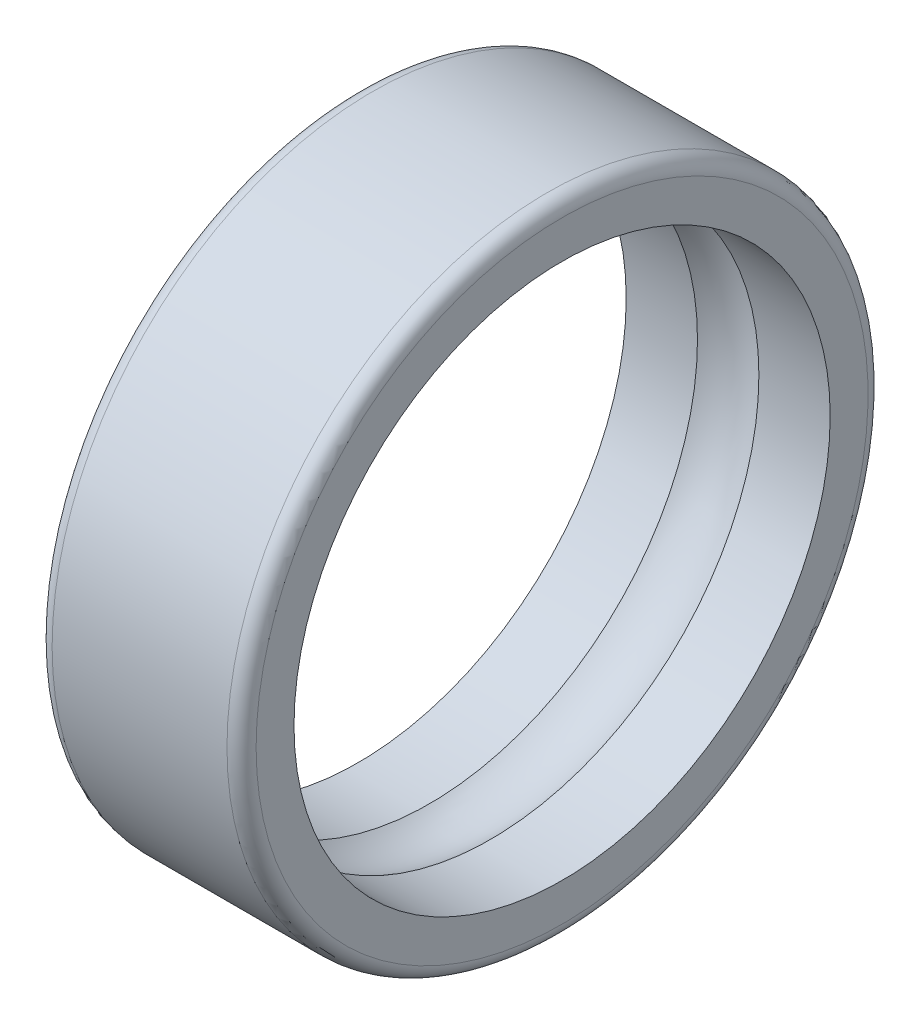
from build123d import *


with BuildPart() as part:
    # Esquisse1 → Base-Révolution (revolve)
    with BuildSketch(Plane.XY, mode=Mode.PRIVATE) as base_r_volution_sk:
        with BuildLine():
            Line((1.053565375, 9.2), (3.5, 9.2))
            Line((3.5, 9.2), (3.5, 10.5))
            ThreePointArc((3.5, 10.5), (3.353553391, 10.853553391), (3, 11))
            Line((3, 11), (-3, 11))
            ThreePointArc((-3, 11), (-3.353553391, 10.853553391), (-3.5, 10.5))
            Line((-3.5, 10.5), (-3.5, 9.2))
            Line((-3.5, 9.2), (-1.053565375, 9.2))
            ThreePointArc((-1.053565375, 9.2), (0, 9.5), (1.053565375, 9.2))
        make_face()
    revolve(base_r_volution_sk.sketch.rotate(Axis((-4.370908092, 0, 0), (1, 0, 0)), 90), axis=Axis((-4.370908092, 0, 0), (1, 0, 0)))


solid = part.part
